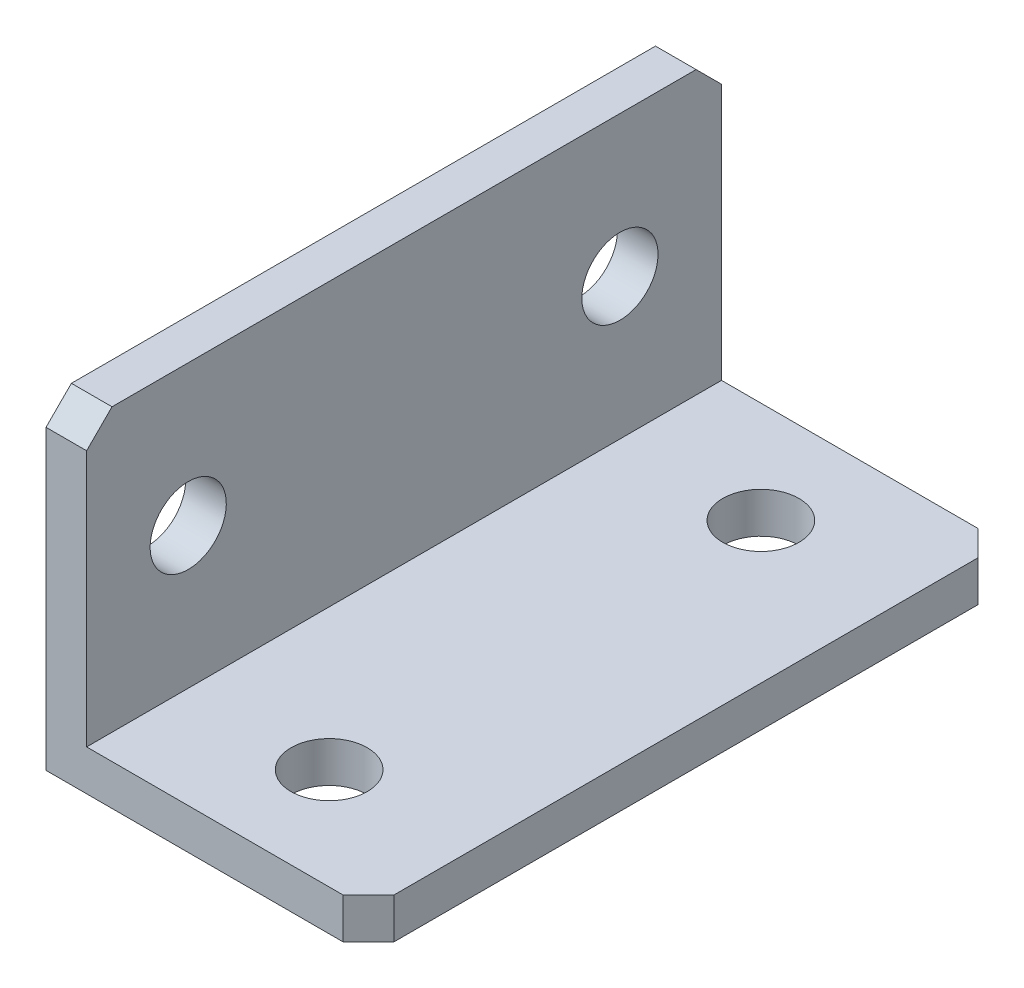
from build123d import *

# Parameters (mm, degrees)
RESSALTO_EXTRUS_O1_DEPTH = 50
CHANFRO1_SIZE            = 2
ESBO_O2_R                = 3
CORTE_EXTRUS_O1_DEPTH    = 60.039647695
ESBO_O3_R                = 3
CORTE_EXTRUS_O2_DEPTH    = 60.039647695


with BuildPart() as part:
    # Esboço1 → Ressalto-extrusão1 (new body)
    with BuildSketch(Plane.XY):
        Polygon((0, 0), (0, 22.2), (-3.2, 22.2), (-3.2, -3.2), (22.2, -3.2), (22.2, 0), align=None)
    extrude(amount=RESSALTO_EXTRUS_O1_DEPTH)

    # Chanfro1
    chanfro1_edges = [part.edges().sort_by_distance(p)[0] for p in [
        (-1.6, 22.2, 50),
        (22.2, -1.6, 50),
        (22.2, -1.6, 0),
        (-1.6, 22.2, 0),
    ]]
    chamfer(chanfro1_edges, length=CHANFRO1_SIZE)

    # Esboço2 → Corte-extrusão1 (cut, through all)
    with BuildSketch(Plane(origin=(0, 0, 0), x_dir=(1, 0, 0), z_dir=(0, 1, 0))):
        with Locations(Location((11.1, -8, 0), (0, 0, 180))):
            Circle(ESBO_O2_R)
        with Locations(Location((11.1, -42, 0), (0, 0, 180))):
            Circle(ESBO_O2_R)
    extrude(amount=-CORTE_EXTRUS_O1_DEPTH, mode=Mode.SUBTRACT)

    # Esboço3 → Corte-extrusão2 (cut, through all)
    with BuildSketch(Plane(origin=(0, 0, 0), x_dir=(0, 0, -1), z_dir=(1, 0, 0))):
        with Locations(Location((-42, 11.1, 0), (0, 0, 90))):
            Circle(ESBO_O3_R)
        with Locations(Location((-8, 11.1, 0), (0, 0, 90))):
            Circle(ESBO_O3_R)
    extrude(amount=-CORTE_EXTRUS_O2_DEPTH, mode=Mode.SUBTRACT)


solid = part.part
